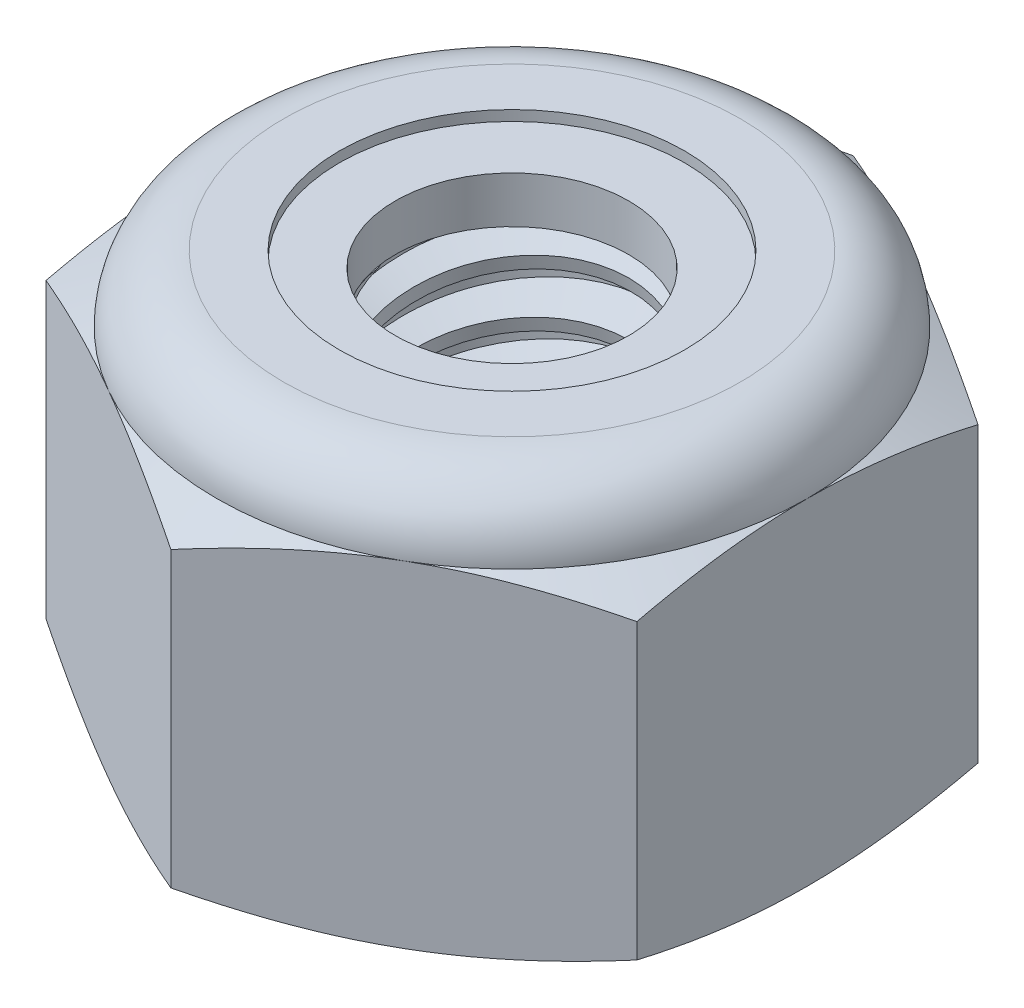
from build123d import *

# Parameters (mm, degrees)
EXTRUDE1_DEPTH      = 5.953125
SKETCH2_W           = 2.0828
SKETCH2_H           = 5.953125
LPATTERN1_COUNT     = 8
LPATTERN1_PITCH     = 0.79375
LPATTERN1_COL_COUNT = 2
LPATTERN1_COL_PITCH = 0.79375


with BuildPart() as part:
    # Sketch1 → Extrude1 (new body)
    with BuildSketch(Plane(origin=(0, 0, 0), x_dir=(1, 0, 0), z_dir=(0, 1, 0))):
        Polygon((0, 5.040989538), (-4.365625, 2.520494769), (-4.365625, -2.520494769), (0, -5.040989538), (4.365625, -2.520494769), (4.365625, 2.520494769), align=None)
    extrude(amount=EXTRUDE1_DEPTH)

    # Sketch4 → Cut-Revolve2 (revolve, cut)
    with BuildSketch(Plane(origin=(0, 0, 0), x_dir=(0, 0, -1), z_dir=(1, 0, 0)), mode=Mode.PRIVATE) as cut_revolve2_sk:
        Polygon((0, 5.953125), (2.0828, 5.953125), (1.725765218, 5.786636947), (1.725765218, 0.166488053), (2.0828, 0), (0, 0), align=None)
    revolve(cut_revolve2_sk.sketch.rotate(Axis((0, 5.953125, 0), (0, 1, 0)), 54.618153421), axis=Axis((0, 5.953125, 0), (0, 1, 0)), mode=Mode.SUBTRACT)


with BuildPart() as body_2:
    # Sketch2 → Revolve1 (revolve)
    with BuildSketch(Plane(origin=(0, 0, 0), x_dir=(0, 0, -1), z_dir=(1, 0, 0))):
        with Locations((1.0414, 2.9765625)):
            Rectangle(SKETCH2_W, SKETCH2_H)
    revolve(axis=Axis((0, -2.0828, 0), (0, 1, 0)))

    # Sketch3 → Cut-Revolve1 (revolve, cut)
    with BuildSketch(Plane(origin=(0, 0, 0), x_dir=(0, 0, -1), z_dir=(1, 0, 0)), mode=Mode.PRIVATE) as cut_revolve1_sk:
        Polygon((2.101371857, 5.855659896), (2.231374854, 5.173404168), (1.762908932, 5.33664843), (1.725765218, 5.531578638), align=None)
    cut_revolve1 = revolve(cut_revolve1_sk.sketch.rotate(Axis((0, 5.953125, 0.162231854), (0, -0.9823254572523517, -0.18718091792156125)), 180), axis=Axis((0, 5.953125, 0.162231854), (0, -0.9823254572523517, -0.18718091792156125)), mode=Mode.SUBTRACT)

    # LPattern1: Cut-Revolve1 ×8
    with Locations(*[(0, -i * LPATTERN1_PITCH, 0) for i in range(1, LPATTERN1_COUNT)]):
        add(cut_revolve1, mode=Mode.SUBTRACT)

    # LPattern1 col: Cut-Revolve1 ×2
    with Locations(*[(0, i * LPATTERN1_COL_PITCH, 0) for i in range(1, LPATTERN1_COL_COUNT)]):
        add(cut_revolve1, mode=Mode.SUBTRACT)


with BuildPart() as part_1:
    add(part.part)

    # Combine1: cut body 2
    add(body_2.part, mode=Mode.SUBTRACT)

    # Sketch5 → Cut-Revolve3 (revolve, cut)
    with BuildSketch(Plane(origin=(0, 0, 0), x_dir=(0, 0, -1), z_dir=(1, 0, 0)), mode=Mode.PRIVATE) as cut_revolve3_sk:
        with BuildLine():
            Line((0, 0), (4.365625, 0))
            Line((4.365625, 0), (5.040989538, 0.314927656))
            Line((5.040989538, 0.314927656), (5.040989538, 4.646009844))
            Line((5.040989538, 4.646009844), (4.365625, 4.9609375))
            ThreePointArc((4.365625, 4.9609375), (4.075020009, 5.662520009), (3.3734375, 5.953125))
            Line((3.3734375, 5.953125), (3.3734375, 7.223125))
            Line((3.3734375, 7.223125), (6.310989538, 7.223125))
            Line((6.310989538, 7.223125), (6.310989538, -1.27))
            Line((6.310989538, -1.27), (0, -1.27))
            Line((0, -1.27), (0, 0))
        make_face()
    revolve(cut_revolve3_sk.sketch.rotate(Axis((0, 0, 0), (0, 1, 0)), 54.618153421), axis=Axis((0, 0, 0), (0, 1, 0)), mode=Mode.SUBTRACT)

    # Sketch6 → Cut-Revolve4 (revolve, cut)
    with BuildSketch(Plane(origin=(0, 0, 0), x_dir=(0, 0, -1), z_dir=(1, 0, 0)), mode=Mode.PRIVATE) as cut_revolve4_sk:
        with BuildLine():
            Line((0, 4.9609375), (4.213225, 4.9609375))
            ThreePointArc((4.213225, 4.9609375), (3.967256936, 5.554756936), (3.3734375, 5.800725))
            Line((3.3734375, 5.800725), (2.549601359, 5.800725))
            Line((2.549601359, 5.800725), (2.549601359, 7.223125))
            Line((2.549601359, 7.223125), (0, 7.223125))
            Line((0, 7.223125), (0, 4.9609375))
        make_face()
    revolve(cut_revolve4_sk.sketch.rotate(Axis((0, 7.223125, 0), (0, 1, 0)), 54.618153421), axis=Axis((0, 7.223125, 0), (0, 1, 0)), mode=Mode.SUBTRACT)


with BuildPart() as body_2_2:
    # Sketch7 → Revolve2 (revolve)
    with BuildSketch(Plane(origin=(0, 0, 0), x_dir=(0, 0, -1), z_dir=(1, 0, 0))):
        with BuildLine():
            Line((1.725765218, 5.0371375), (4.133213408, 5.0371375))
            ThreePointArc((4.133213408, 5.0371375), (3.885726726, 5.527175629), (3.3734375, 5.724525))
            Line((3.3734375, 5.724525), (1.725765218, 5.724525))
            Line((1.725765218, 5.724525), (1.725765218, 5.0371375))
        make_face()
    revolve(axis=Axis((0, 5.0371375, 0), (0, 1, 0)))


solid = Compound([part_1.part, body_2_2.part])
